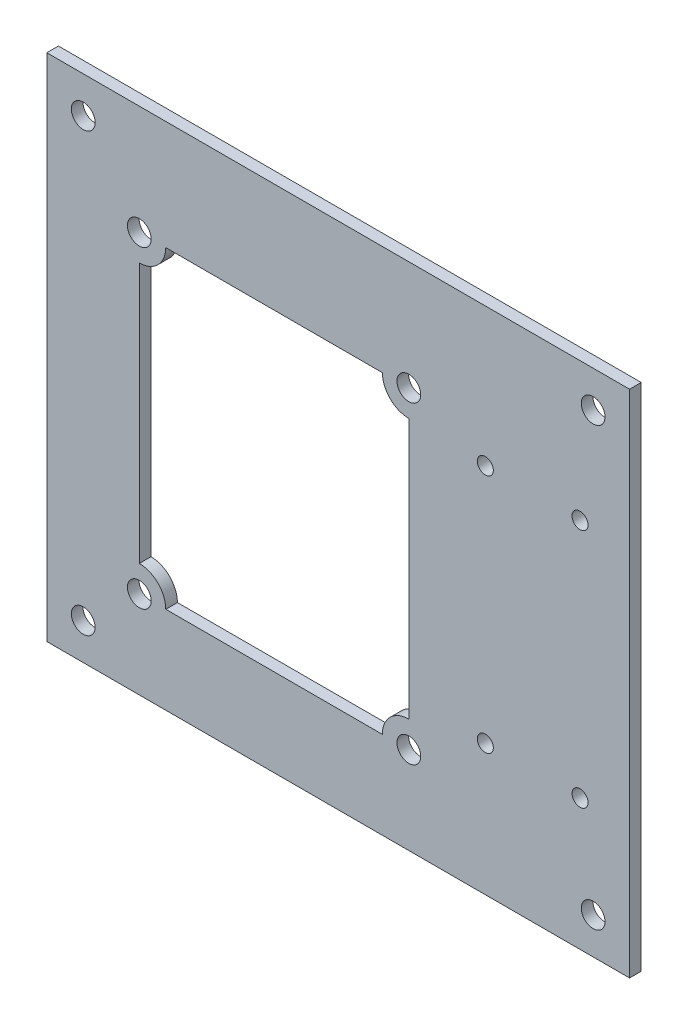
from build123d import *

# Parameters (mm, degrees)
SKETCH1_W           = 80
SKETCH1_H           = 70
SKETCH1_R           = 1.63195
SKETCH1_R_2         = 1.1
BOSS_EXTRUDE1_DEPTH = 1.6


with BuildPart() as part:
    # Sketch1 → Boss-Extrude1 (new body)
    with BuildSketch(Plane.XY):
        with Locations((35, -30)):
            Rectangle(SKETCH1_W, SKETCH1_H)
        with Locations((0, -60)):
            Circle(SKETCH1_R, mode=Mode.SUBTRACT)
        with BuildLine():
            Line((7.7, -49.36805), (7.7, -13.63195))
            ThreePointArc((7.7, -13.63195), (10.268176474, -12.568176474), (11.33195, -10))
            Line((11.33195, -10), (41.06805, -10))
            ThreePointArc((41.06805, -10), (42.131823526, -12.568176474), (44.7, -13.63195))
            Line((44.7, -13.63195), (44.7, -49.36805))
            ThreePointArc((44.7, -49.36805), (42.131823526, -50.431823526), (41.06805, -53))
            Line((41.06805, -53), (11.33195, -53))
            ThreePointArc((11.33195, -53), (10.268176474, -50.431823526), (7.7, -49.36805))
        make_face(mode=Mode.SUBTRACT)
        with Locations((70, -60)):
            Circle(SKETCH1_R, mode=Mode.SUBTRACT)
        with Locations((55.2, -47)):
            Circle(SKETCH1_R_2, mode=Mode.SUBTRACT)
        with Locations((68.2, -47)):
            Circle(SKETCH1_R_2, mode=Mode.SUBTRACT)
        Circle(SKETCH1_R, mode=Mode.SUBTRACT)
        with Locations((55.2, -14)):
            Circle(SKETCH1_R_2, mode=Mode.SUBTRACT)
        with Locations((68.2, -14)):
            Circle(SKETCH1_R_2, mode=Mode.SUBTRACT)
        with Locations((70, 0)):
            Circle(SKETCH1_R, mode=Mode.SUBTRACT)
        with Locations((7.7, -10)):
            Circle(SKETCH1_R, mode=Mode.SUBTRACT)
        with Locations((44.7, -10)):
            Circle(SKETCH1_R, mode=Mode.SUBTRACT)
        with Locations((7.7, -53)):
            Circle(SKETCH1_R, mode=Mode.SUBTRACT)
        with Locations((44.7, -53)):
            Circle(SKETCH1_R, mode=Mode.SUBTRACT)
    extrude(amount=BOSS_EXTRUDE1_DEPTH)


solid = part.part
